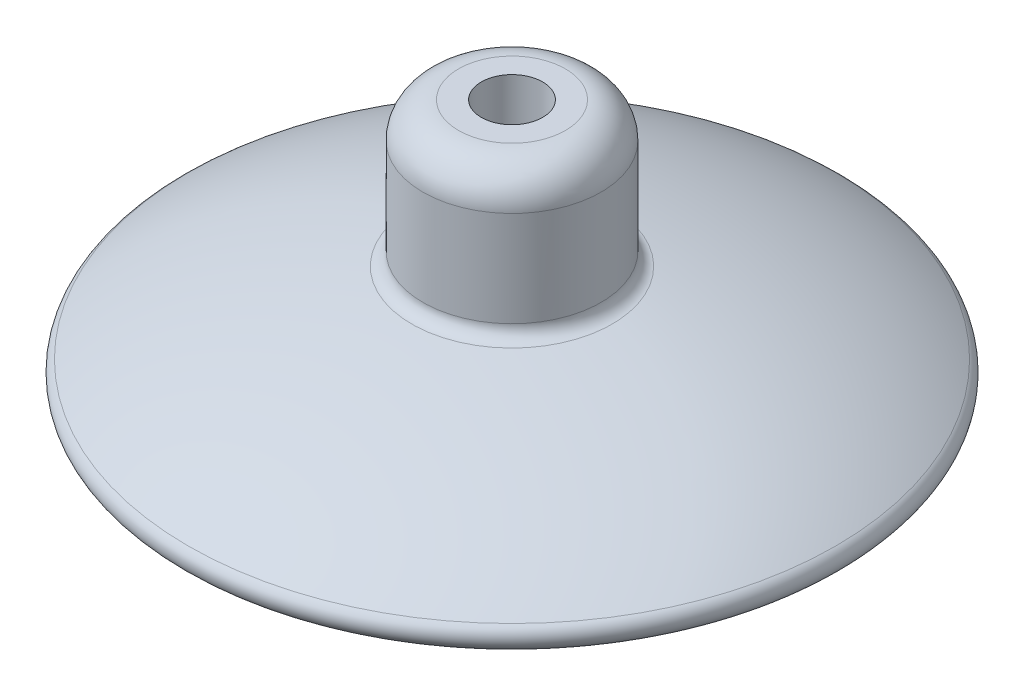
from build123d import *

# Parameters (mm, degrees)
SKETCH1_R           = 5
BOSS_EXTRUDE1_DEPTH = 8
SKETCH3_R           = 3.45
CUT_EXTRUDE1_DEPTH  = 4.19
SKETCH4_R           = 1.725
CUT_EXTRUDE2_DEPTH  = 30.937202742
FILLET1_R           = 0.75
FILLET2_R           = 2


with BuildPart() as part:
    # Sketch1 → Boss-Extrude1 (new body)
    with BuildSketch(Plane(origin=(0, 0, 0), x_dir=(1, 0, 0), z_dir=(0, 1, 0))):
        with Locations(Location((0, 0, 0), (0, 0, 270))):
            Circle(SKETCH1_R)
    extrude(amount=BOSS_EXTRUDE1_DEPTH)

    # Sketch2 → Revolve1 (revolve)
    with BuildSketch(Plane.XY):
        with BuildLine():
            add(Edge.make_bspline(
                [(-20, -6), (-14.656287037, -1.492043213), (-5, 0)],
                knots=[0, 0, 0, 1, 1, 1], degree=2))
            Line((-5, 0), (0, 0))
            Line((0, 0), (0, -6))
            Line((0, -6), (-20, -6))
        make_face()
    revolve(axis=Axis((0, 0, 0), (0, -1, 0)))

    # Sketch3 → Cut-Extrude1 (cut)
    with BuildSketch(Plane.XZ.offset(6)):
        Circle(SKETCH3_R)
    extrude(amount=-CUT_EXTRUDE1_DEPTH, mode=Mode.SUBTRACT)

    # Sketch4 → Cut-Extrude2 (cut, through all)
    with BuildSketch(Plane.XZ.offset(1.81)):
        Circle(SKETCH4_R)
    extrude(amount=-CUT_EXTRUDE2_DEPTH, mode=Mode.SUBTRACT)

    # Fillet1
    fillet1_edges = [part.edges().sort_by_distance(p)[0] for p in [
        (20, -6, 0),
        (3.535533906, 0, -3.535533906),
    ]]
    fillet(fillet1_edges, radius=FILLET1_R)

    # Fillet2
    fillet2_edges = [part.edges().sort_by_distance(p)[0] for p in [
        (0, 8, -5),
    ]]
    fillet(fillet2_edges, radius=FILLET2_R)


solid = part.part
